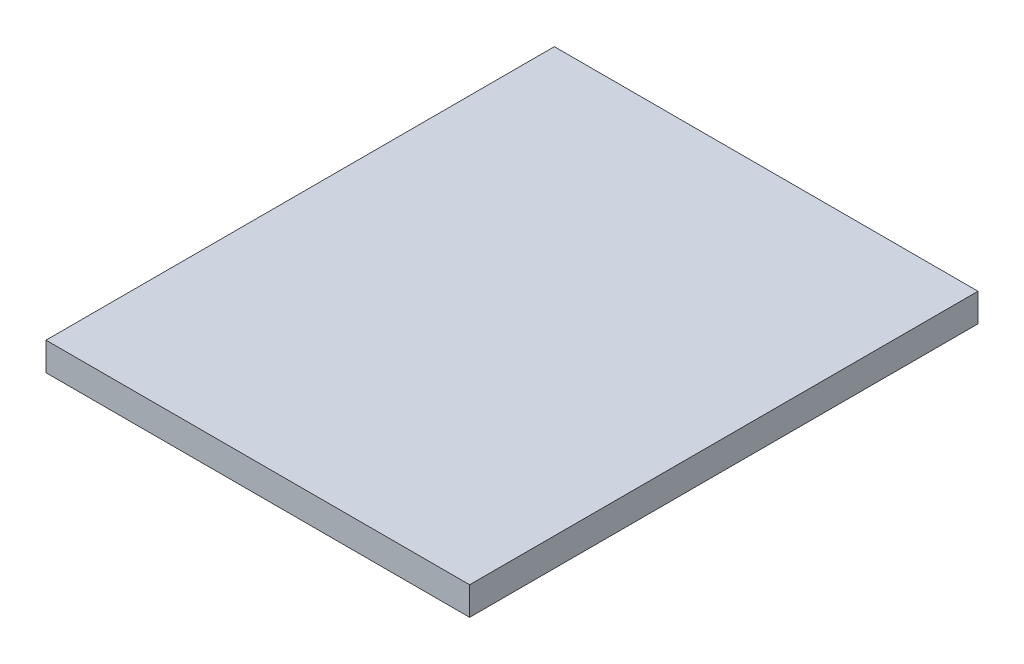
from build123d import *

# Parameters (mm, degrees)
SKETCH1_W           = 95.25
SKETCH1_H           = 114.3
BOSS_EXTRUDE1_DEPTH = 3.175


with BuildPart() as part:
    # Sketch1 → Boss-Extrude1 (new, symmetric)
    with BuildSketch(Plane(origin=(0, 0, 0), x_dir=(1, 0, 0), z_dir=(0, 1, 0))):
        Rectangle(SKETCH1_W, SKETCH1_H)
    extrude(amount=BOSS_EXTRUDE1_DEPTH, both=True)


solid = part.part
